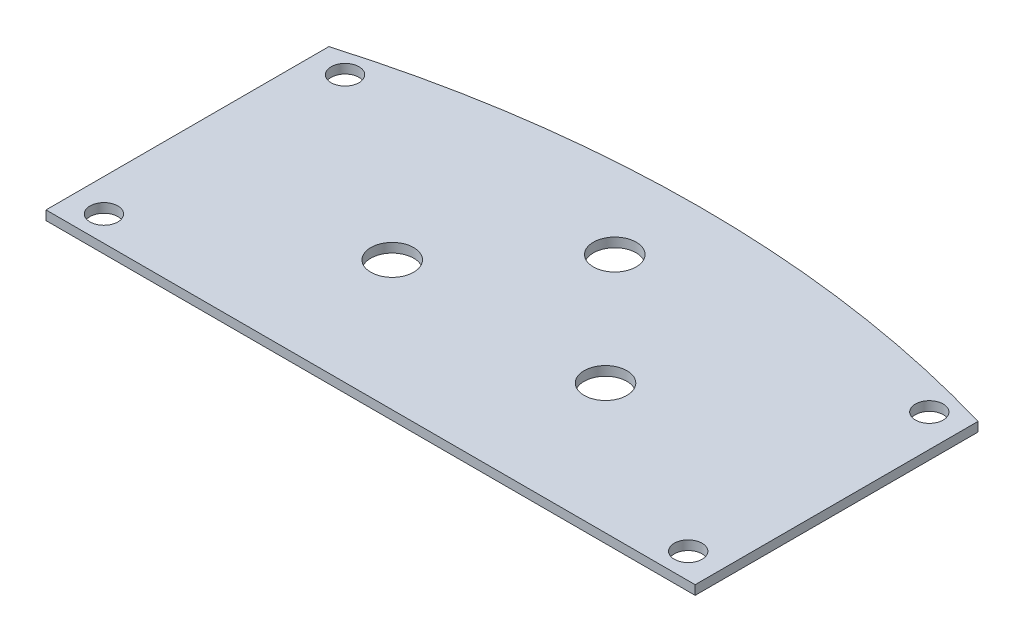
from build123d import *

# Parameters (mm, degrees)
BOSS_EXTRUDE1_DEPTH = 3
SKETCH3_R           = 3
CUT_EXTRUDE1_DEPTH  = 10
SKETCH4_R           = 4.62
CUT_EXTRUDE2_DEPTH  = 10
SKETCH5_W           = 140
SKETCH5_H           = 1
CUT_EXTRUDE3_DEPTH  = 80


with BuildPart() as part:
    # Sketch1 → Boss-Extrude1 (new body)
    with BuildSketch(Plane(origin=(0, 0, 0), x_dir=(1, 0, 0), z_dir=(0, 1, 0))):
        with BuildLine():
            Line((70, 28.5), (70, -32.5))
            Line((70, -32.5), (-70, -32.5))
            Line((-70, -32.5), (-70, 28.5))
            ThreePointArc((-70, 28.5), (0, 38.554020598), (70, 28.5))
        make_face()
    extrude(amount=BOSS_EXTRUDE1_DEPTH)

    # Sketch3 → Cut-Extrude1 (cut)
    with BuildSketch(Plane(origin=(0, 3, 0), x_dir=(1, 0, 0), z_dir=(0, 1, 0))):
        with Locations(Location((-63, 25, 0), (0, 0, 270))):
            Circle(SKETCH3_R)
        with Locations(Location((-63, -27, 0), (0, 0, 270))):
            Circle(SKETCH3_R)
        with Locations(Location((63, 25, 0), (0, 0, 270))):
            Circle(SKETCH3_R)
        with Locations(Location((63, -27, 0), (0, 0, 270))):
            Circle(SKETCH3_R)
    extrude(amount=-CUT_EXTRUDE1_DEPTH, mode=Mode.SUBTRACT)

    # Sketch4 → Cut-Extrude2 (cut)
    with BuildSketch(Plane(origin=(0, 3, 0), x_dir=(1, 0, 0), z_dir=(0, 1, 0))):
        with Locations(Location((-23.33, -4.5, 0), (0, 0, 270))):
            Circle(SKETCH4_R)
        with Locations(Location((22.67, -4.5, 0), (0, 0, 270))):
            Circle(SKETCH4_R)
        with Locations(Location((-0.33, 20.499217988, 0), (0, 0, 270))):
            Circle(SKETCH4_R)
    extrude(amount=-CUT_EXTRUDE2_DEPTH, mode=Mode.SUBTRACT)

    # Sketch5 → Cut-Extrude3 (cut)
    with BuildSketch(Plane.XY.offset(32.5)):
        with Locations((0, 0.5)):
            Rectangle(SKETCH5_W, SKETCH5_H)
    extrude(amount=-CUT_EXTRUDE3_DEPTH, mode=Mode.SUBTRACT)


solid = part.part
